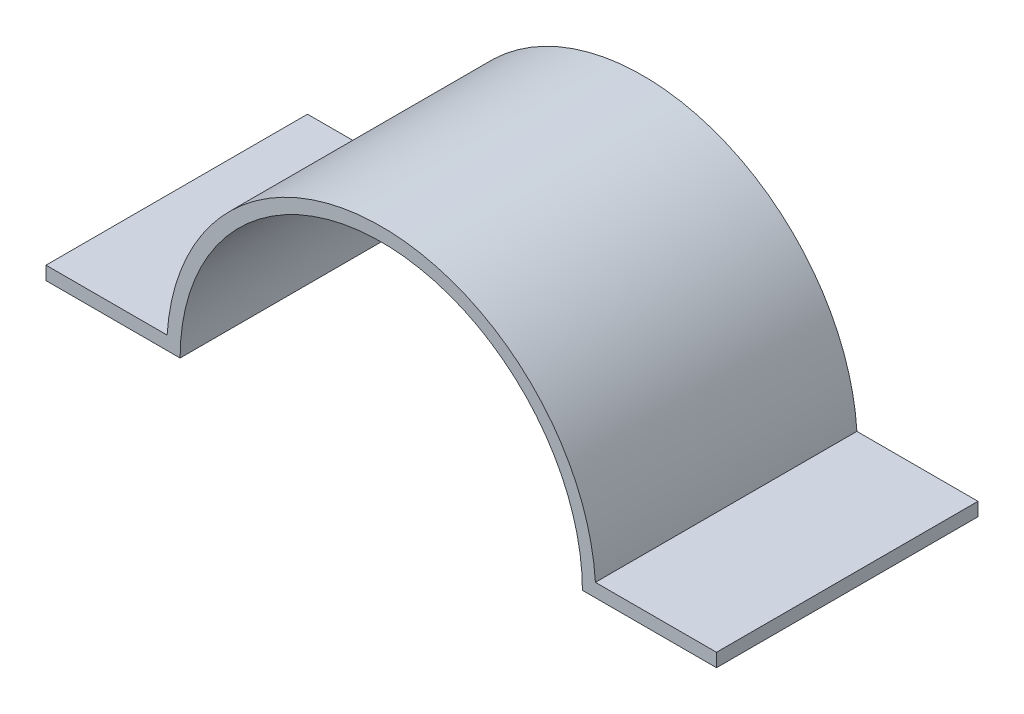
from build123d import *

# Parameters (mm, degrees)
EXTRUDE_THIN2_DEPTH = 39


with BuildPart() as part:
    # Sketch1 → Extrude-Thin2 (new body)
    with BuildSketch(Plane.XY):
        with BuildLine():
            Line((0, 0), (20, 0))
            ThreePointArc((20, 0), (50, 30), (80, 0))
            Line((80, 0), (100, 0))
            Line((100, 0), (100, 2))
            Line((100, 2), (81.937438845, 2))
            ThreePointArc((81.937438845, 2), (50, 32), (18.062561155, 2))
            Line((18.062561155, 2), (0, 2))
            Line((0, 2), (0, 0))
        make_face()
    extrude(amount=EXTRUDE_THIN2_DEPTH)


solid = part.part
